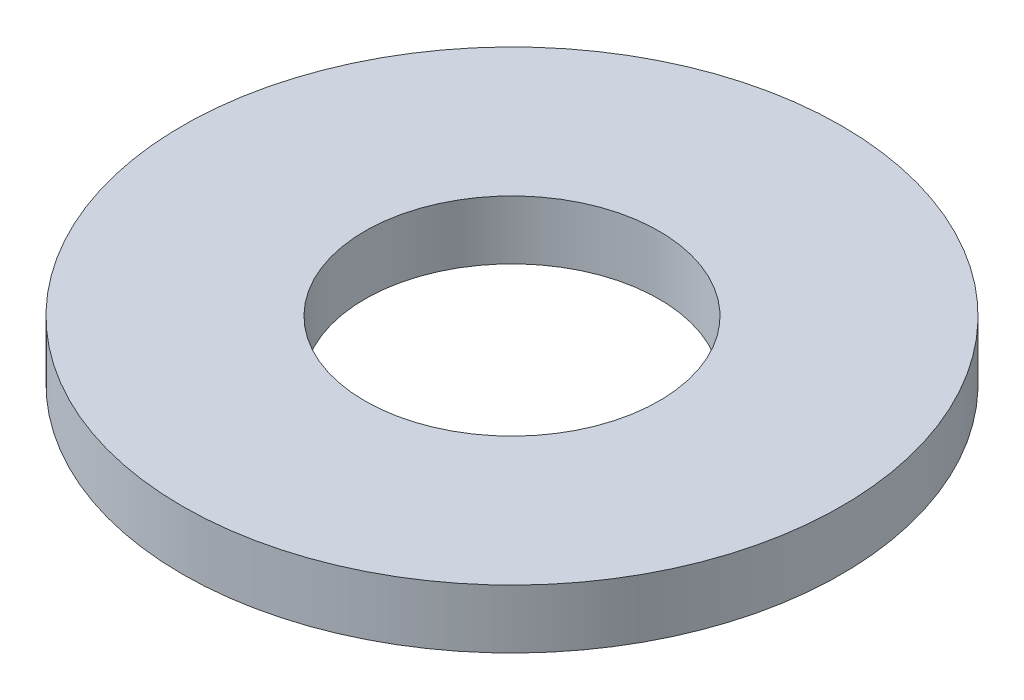
from build123d import *

# Parameters (mm, degrees)
SKETCH1_R           = 17.78
SKETCH1_R_2         = 7.9375
BOSS_EXTRUDE1_DEPTH = 3.175


with BuildPart() as part:
    # Sketch1 → Boss-Extrude1 (new body)
    with BuildSketch(Plane(origin=(0, 0, 0), x_dir=(1, 0, 0), z_dir=(0, 1, 0))):
        with Locations(Location((0, 0, 0), (0, 0, 270))):
            Circle(SKETCH1_R)
        with Locations(Location((0, 0, 0), (0, 0, 270))):
            Circle(SKETCH1_R_2, mode=Mode.SUBTRACT)
    extrude(amount=BOSS_EXTRUDE1_DEPTH)


solid = part.part
